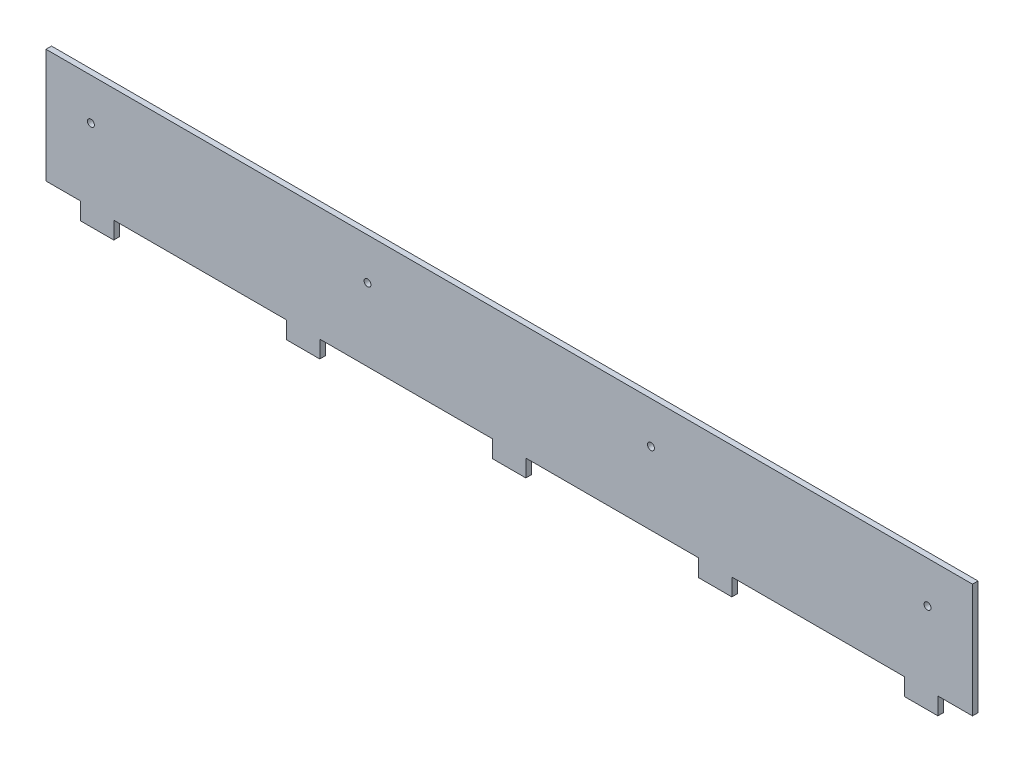
from build123d import *

# Parameters (mm, degrees)
SKETCH_1_W          = 670
SKETCH_1_H          = 95
EXTRUDE_1_DEPTH     = 2
SKETCH_2_W          = 125
SKETCH_2_H          = 12.454397838
CUT_EXTRUDE_1_DEPTH = 339.374422792
SKETCH_5_R          = 2.5
CUT_EXTRUDE_4_DEPTH = 339.374422792


with BuildPart() as part:
    # Эскиз1 → Бобышка-Вытянуть1 (new, symmetric)
    with BuildSketch(Plane.XY):
        Rectangle(SKETCH_1_W, SKETCH_1_H)
    extrude(amount=EXTRUDE_1_DEPTH, both=True)

    # Эскиз2 → Вырез-Вытянуть1 (cut, through all)
    with BuildSketch(Plane.XY.offset(2)):
        with Locations((-372.5, -41.272801081)):
            Rectangle(SKETCH_2_W, SKETCH_2_H)
        with Locations((-223.5, -41.272801081)):
            Rectangle(SKETCH_2_W, SKETCH_2_H)
        with Locations((-74.5, -41.272801081)):
            Rectangle(SKETCH_2_W, SKETCH_2_H)
        with Locations((74.5, -41.272801081)):
            Rectangle(SKETCH_2_W, SKETCH_2_H)
        with Locations((223.5, -41.272801081)):
            Rectangle(SKETCH_2_W, SKETCH_2_H)
        with Locations((372.5, -41.272801081)):
            Rectangle(SKETCH_2_W, SKETCH_2_H)
    extrude(amount=-CUT_EXTRUDE_1_DEPTH, mode=Mode.SUBTRACT)

    # Эскиз5 → Вырез-Вытянуть4 (cut, through all)
    with BuildSketch(Plane.XY.offset(2)):
        with Locations((-102.5, 17.5)):
            Circle(SKETCH_5_R)
        with Locations((102.5, 17.5)):
            Circle(SKETCH_5_R)
        with Locations((-302.5, 17.5)):
            Circle(SKETCH_5_R)
        with Locations((302.5, 17.5)):
            Circle(SKETCH_5_R)
    extrude(amount=-CUT_EXTRUDE_4_DEPTH, mode=Mode.SUBTRACT)


solid = part.part
